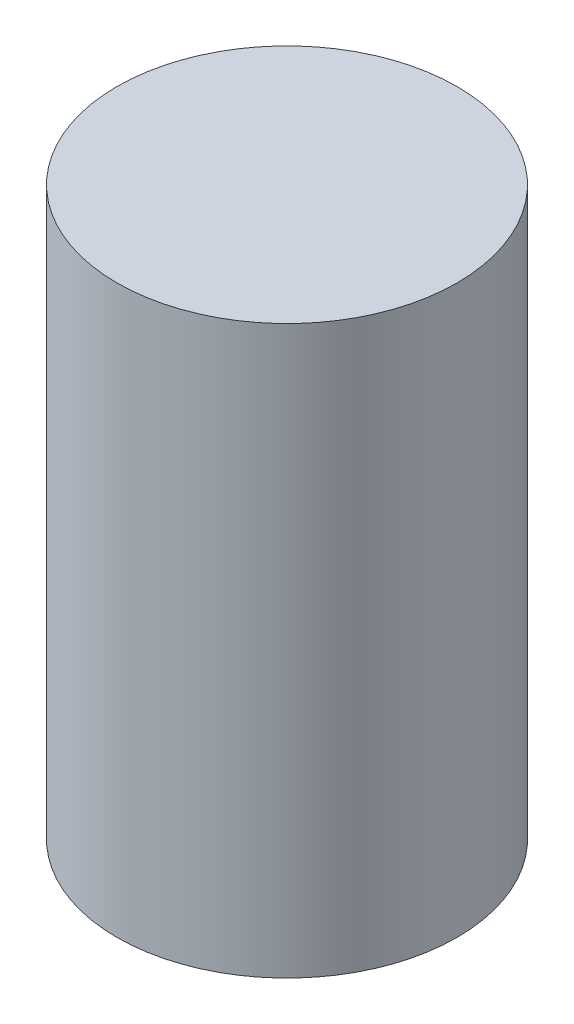
from build123d import *

# Parameters (mm, degrees)
SKETCH_1_R      = 3
EXTRUDE_1_DEPTH = 10


with BuildPart() as part:
    # 草图1 → 凸台-拉伸1 (new body)
    with BuildSketch(Plane(origin=(0, 0, 0), x_dir=(1, 0, 0), z_dir=(0, 1, 0))):
        with Locations(Location((0, 0, 0), (0, 0, 270))):
            Circle(SKETCH_1_R)
    extrude(amount=EXTRUDE_1_DEPTH)


solid = part.part
